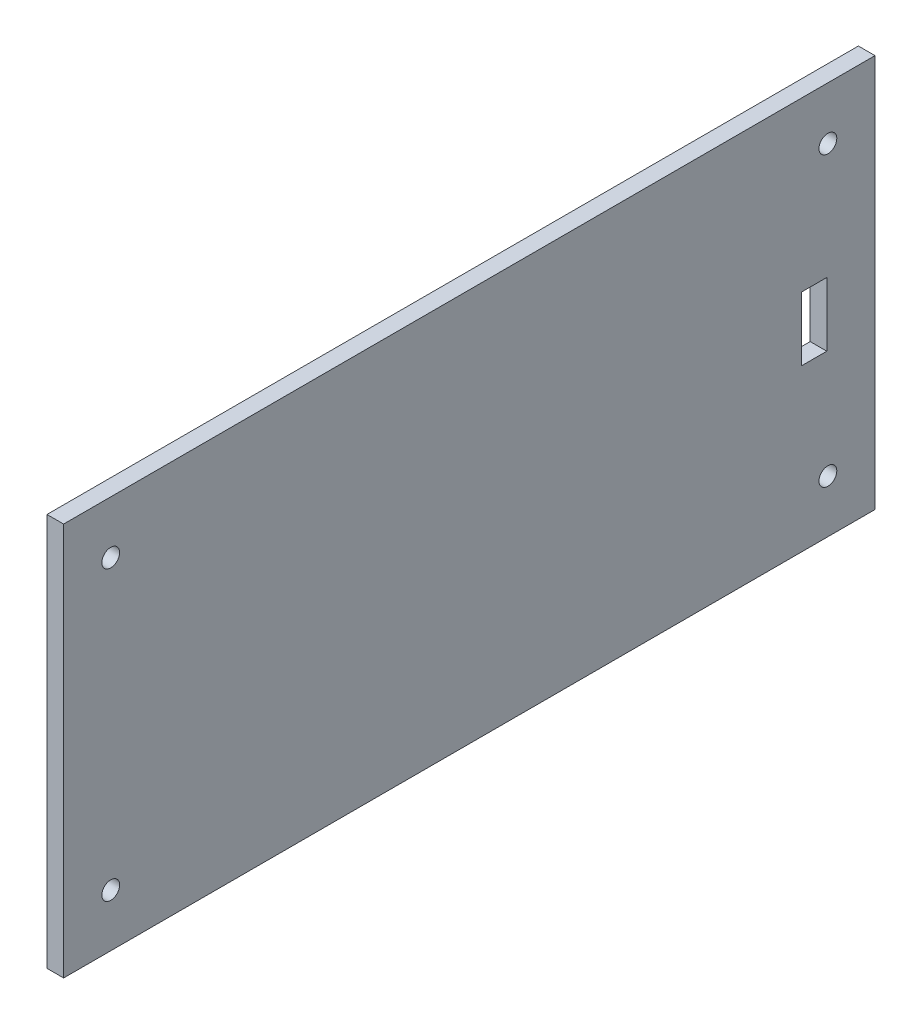
from build123d import *

# Parameters (mm, degrees)
SKETCH3_W           = 155
SKETCH3_H           = 75.1
SKETCH3_R           = 1.7
SKETCH3_W_2         = 4.8
SKETCH3_H_2         = 12.2
BOSS_EXTRUDE1_DEPTH = 3.175


with BuildPart() as part:
    # Sketch3 → Boss-Extrude1 (new body)
    with BuildSketch(Plane(origin=(0, 0, 0), x_dir=(0, 0, -1), z_dir=(1, 0, 0))):
        with Locations((77.5, 37.55)):
            Rectangle(SKETCH3_W, SKETCH3_H)
        with Locations((9, 10.05)):
            Circle(SKETCH3_R, mode=Mode.SUBTRACT)
        with Locations((146, 10.05)):
            Circle(SKETCH3_R, mode=Mode.SUBTRACT)
        with Locations((146, 65.05)):
            Circle(SKETCH3_R, mode=Mode.SUBTRACT)
        with Locations((9, 65.05)):
            Circle(SKETCH3_R, mode=Mode.SUBTRACT)
        with Locations((143.391666667, 36.9)):
            Rectangle(SKETCH3_W_2, SKETCH3_H_2, mode=Mode.SUBTRACT)
    extrude(amount=BOSS_EXTRUDE1_DEPTH)


solid = part.part
